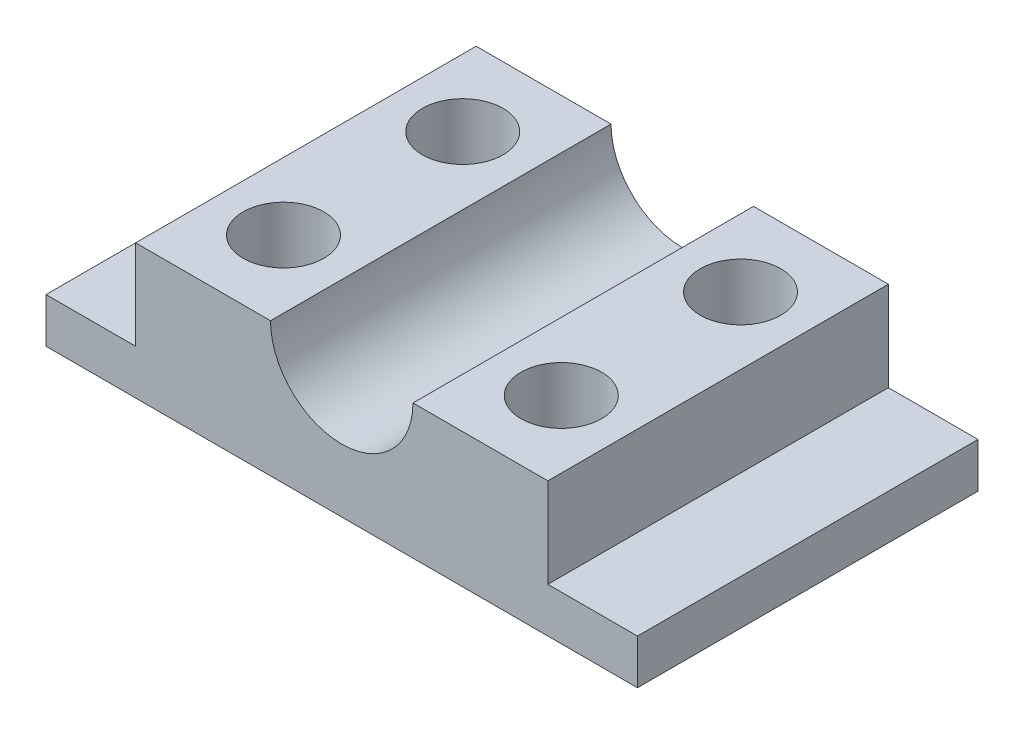
from build123d import *

# Parameters (mm, degrees)
SKETCH1_W              = 46
SKETCH1_H              = 38
BOSS_EXTRUDE1_DEPTH    = 15
M10X1_0_TAPPED_HOLE1_D = 9
SKETCH7_R              = 7.95
CUT_EXTRUDE1_DEPTH     = 62.522353661
SKETCH17_W             = 38
SKETCH17_H             = 5
BOSS_EXTRUDE2_DEPTH    = 10
SKETCH18_W             = 38
SKETCH18_H             = 5
BOSS_EXTRUDE3_DEPTH    = 10


with BuildPart() as part:
    # Sketch1 → Boss-Extrude1 (new body)
    with BuildSketch(Plane(origin=(0, 0, 0), x_dir=(1, 0, 0), z_dir=(0, 1, 0))):
        with Locations((23, 19)):
            Rectangle(SKETCH1_W, SKETCH1_H)
    extrude(amount=BOSS_EXTRUDE1_DEPTH)

    # M10x1.0 Tapped Hole1 (through all)
    with Locations(Plane(origin=(0, 15, 0), x_dir=(1, 0, 0), z_dir=(0, 1, 0))):
        with Locations((7.5, 29), (38.5, 29), (38.5, 9), (7.5, 9)):
            Hole(M10X1_0_TAPPED_HOLE1_D / 2)

    # Sketch7 → Cut-Extrude1 (cut, through all)
    with BuildSketch(Plane.XY):
        with Locations((23, 15)):
            Circle(SKETCH7_R)
    extrude(amount=-CUT_EXTRUDE1_DEPTH, mode=Mode.SUBTRACT)

    # Sketch17 → Boss-Extrude2 (add)
    with BuildSketch(Plane(origin=(46, 0, 0), x_dir=(0, 0, -1), z_dir=(1, 0, 0))):
        with Locations((19, 2.5)):
            Rectangle(SKETCH17_W, SKETCH17_H)
    extrude(amount=BOSS_EXTRUDE2_DEPTH)

    # Sketch18 → Boss-Extrude3 (add)
    with BuildSketch(Plane.ZY):
        with Locations((-19, 2.5)):
            Rectangle(SKETCH18_W, SKETCH18_H)
    extrude(amount=BOSS_EXTRUDE3_DEPTH)


solid = part.part
